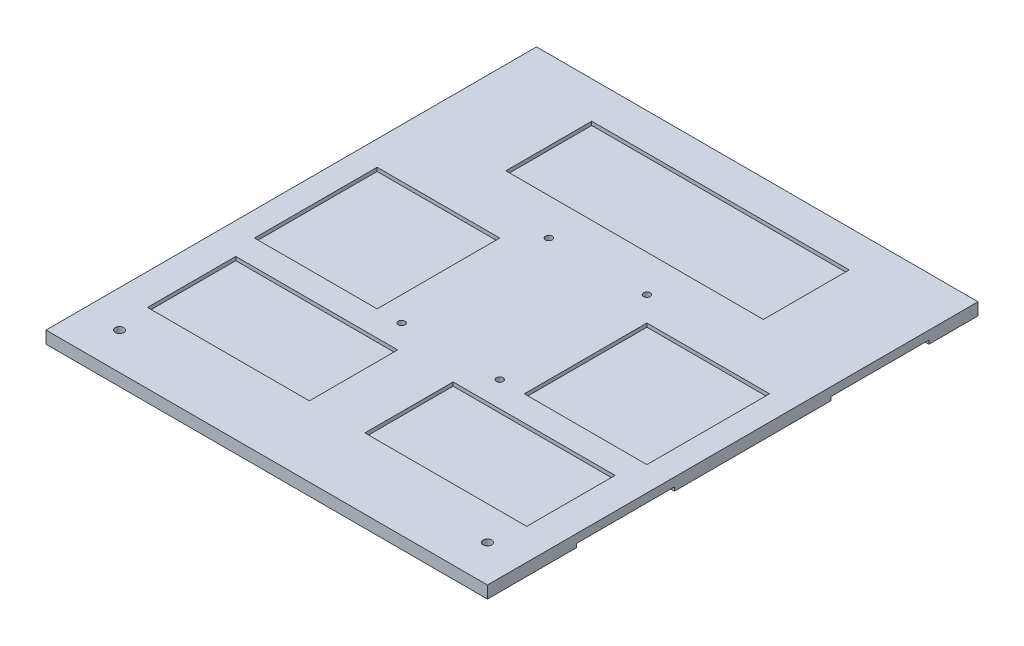
from build123d import *

# Parameters (mm, degrees)
SKETCH1_W           = 180
SKETCH1_H           = 200
BOSS_EXTRUDE1_DEPTH = 12.5
SKETCH2_W           = 85
SKETCH2_H           = 55
CUT_EXTRUDE1_DEPTH  = 1.5
SKETCH3_W           = 105
SKETCH3_H           = 35
CUT_EXTRUDE2_DEPTH  = 1.5
SKETCH4_W           = 180
SKETCH4_H           = 200
CUT_EXTRUDE3_DEPTH  = 4.5
SKETCH5_W           = 180
SKETCH5_H           = 200
CUT_EXTRUDE4_DEPTH  = 3
SKETCH7_W           = 85
SKETCH7_H           = 55
BOSS_EXTRUDE2_DEPTH = 1.5
SKETCH8_W           = 50
SKETCH8_H           = 50
CUT_EXTRUDE5_DEPTH  = 1.5
SKETCH9_W           = 66
SKETCH9_H           = 36
CUT_EXTRUDE6_DEPTH  = 1.5
SKETCH11_W          = 80
SKETCH11_H          = 40
SKETCH11_W_2        = 97
SKETCH11_H_2        = 20
CUT_EXTRUDE9_DEPTH  = 1.5
SKETCH15_R          = 1.35
CUT_EXTRUDE11_DEPTH = 135.629120178
SKETCH16_R          = 1.75
CUT_EXTRUDE12_DEPTH = 5


with BuildPart() as part:
    # Sketch1 → Boss-Extrude1 (new body)
    with BuildSketch(Plane(origin=(0, 0, 0), x_dir=(1, 0, 0), z_dir=(0, 1, 0))):
        Rectangle(SKETCH1_W, SKETCH1_H)
    extrude(amount=BOSS_EXTRUDE1_DEPTH)

    # Sketch2 → Cut-Extrude1 (cut)
    with BuildSketch(Plane(origin=(0, 12.5, 0), x_dir=(1, 0, 0), z_dir=(0, 1, 0))):
        Rectangle(SKETCH2_W, SKETCH2_H)
    extrude(amount=-CUT_EXTRUDE1_DEPTH, mode=Mode.SUBTRACT)

    # Sketch3 → Cut-Extrude2 (cut)
    with BuildSketch(Plane(origin=(0, 12.5, 0), x_dir=(1, 0, 0), z_dir=(0, 1, 0))):
        with Locations((0, 67.5)):
            Rectangle(SKETCH3_W, SKETCH3_H)
    extrude(amount=-CUT_EXTRUDE2_DEPTH, mode=Mode.SUBTRACT)

    # Sketch4 → Cut-Extrude3 (cut)
    with BuildSketch(Plane.XZ):
        Rectangle(SKETCH4_W, SKETCH4_H)
    extrude(amount=-CUT_EXTRUDE3_DEPTH, mode=Mode.SUBTRACT)

    # Sketch5 → Cut-Extrude4 (cut)
    with BuildSketch(Plane.XZ.offset(-4.5)):
        Rectangle(SKETCH5_W, SKETCH5_H)
    extrude(amount=-CUT_EXTRUDE4_DEPTH, mode=Mode.SUBTRACT)

    # Sketch7 → Boss-Extrude2 (add)
    with BuildSketch(Plane(origin=(0, 11, 0), x_dir=(1, 0, 0), z_dir=(0, 1, 0))):
        Rectangle(SKETCH7_W, SKETCH7_H)
    extrude(amount=BOSS_EXTRUDE2_DEPTH)

    # Sketch8 → Cut-Extrude5 (cut)
    with BuildSketch(Plane(origin=(0, 12.5, 0), x_dir=(1, 0, 0), z_dir=(0, 1, 0))):
        with Locations((55, 0)):
            Rectangle(SKETCH8_W, SKETCH8_H)
        with Locations((-55, 0)):
            Rectangle(SKETCH8_W, SKETCH8_H)
    extrude(amount=-CUT_EXTRUDE5_DEPTH, mode=Mode.SUBTRACT)

    # Sketch9 → Cut-Extrude6 (cut)
    with BuildSketch(Plane(origin=(0, 12.5, 0), x_dir=(1, 0, 0), z_dir=(0, 1, 0))):
        with Locations((44.314846592, -53.31046024)):
            Rectangle(SKETCH9_W, SKETCH9_H)
        with Locations((-44.314846592, -53.31046024)):
            Rectangle(SKETCH9_W, SKETCH9_H)
    extrude(amount=-CUT_EXTRUDE6_DEPTH, mode=Mode.SUBTRACT)

    # Sketch11 → Cut-Extrude9 (cut)
    with BuildSketch(Plane.XZ.offset(-7.5)):
        with Locations((-90, 43.788146999)):
            Rectangle(SKETCH11_W, SKETCH11_H)
        with Locations((-90, -61.211853001)):
            Rectangle(SKETCH11_W, SKETCH11_H)
        with Locations((90, -60)):
            Rectangle(SKETCH11_W, SKETCH11_H)
        with Locations((0, 89.411235459)):
            Rectangle(SKETCH11_W_2, SKETCH11_H_2)
        with Locations((90, 43.788146999)):
            Rectangle(SKETCH11_W, SKETCH11_H)
    extrude(amount=-CUT_EXTRUDE9_DEPTH, mode=Mode.SUBTRACT)

    # Sketch15 → Cut-Extrude11 (cut, through all)
    with BuildSketch(Plane.XZ.offset(-7.5)):
        with Locations(Location((-20, 25, 0), (0, 0, 270))):
            Circle(SKETCH15_R)
        with Locations(Location((20, 25, 0), (0, 0, 270))):
            Circle(SKETCH15_R)
        with Locations(Location((-20, -35, 0), (0, 0, 270))):
            Circle(SKETCH15_R)
        with Locations(Location((20, -35, 0), (0, 0, 270))):
            Circle(SKETCH15_R)
    extrude(amount=-CUT_EXTRUDE11_DEPTH, mode=Mode.SUBTRACT)

    # Sketch16 → Cut-Extrude12 (cut)
    with BuildSketch(Plane(origin=(0, 12.5, 0), x_dir=(1, 0, 0), z_dir=(0, 1, 0))):
        with Locations(Location((-75, -85, 0), (0, 0, 270))):
            Circle(SKETCH16_R)
        with Locations(Location((75, -85, 0), (0, 0, 90))):
            Circle(SKETCH16_R)
    extrude(amount=-CUT_EXTRUDE12_DEPTH, mode=Mode.SUBTRACT)


solid = part.part
